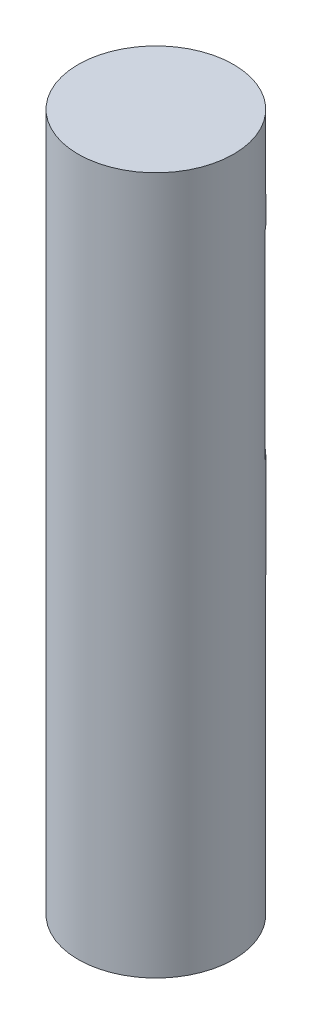
from build123d import *
from build123d.topology import SkipClean

# Parameters (mm, degrees)
BOSS_EXTRUDE1_DEPTH = 44.45
BOSS_EXTRUDE2_DEPTH = 25.4
BOSS_EXTRUDE3_START = -6.35
BOSS_EXTRUDE3_DEPTH = 6.35


with BuildPart() as part:
    # Sketch1 → Boss-Extrude1 (new body)
    with BuildSketch(Plane(origin=(0, 0, 0), x_dir=(1, 0, 0), z_dir=(0, 1, 0))):
        with BuildLine():
            Line((-3.941092361, 3), (3.941092361, 3))
            ThreePointArc((3.941092361, 3), (0, -4.953), (-3.941092361, 3))
        make_face()
    extrude(amount=BOSS_EXTRUDE1_DEPTH)

    # Sketch3 → Boss-Extrude2 (add)
    with SkipClean():  # the faces are left unmerged after this step: merging them gives an invalid solid
        with BuildSketch(Plane.XZ):
            with BuildLine():
                Line((-3.941092361, -3), (3.941092361, -3))
                ThreePointArc((3.941092361, -3), (0, -4.953), (-3.941092361, -3))
            make_face()
        extrude(amount=-BOSS_EXTRUDE2_DEPTH)

    # Sketch4 → Boss-Extrude3 (add)
    with SkipClean():  # the faces are left unmerged after this step: merging them gives an invalid solid
        with BuildSketch(Plane(origin=(0, 44.45, 0), x_dir=(1, 0, 0), z_dir=(0, 1, 0)).offset(BOSS_EXTRUDE3_START)):
            with BuildLine():
                Line((-3.941092361, 3), (3.941092361, 3))
                ThreePointArc((3.941092361, 3), (0, 4.953), (-3.941092361, 3))
            make_face()
        extrude(amount=BOSS_EXTRUDE3_DEPTH)


solid = part.part
